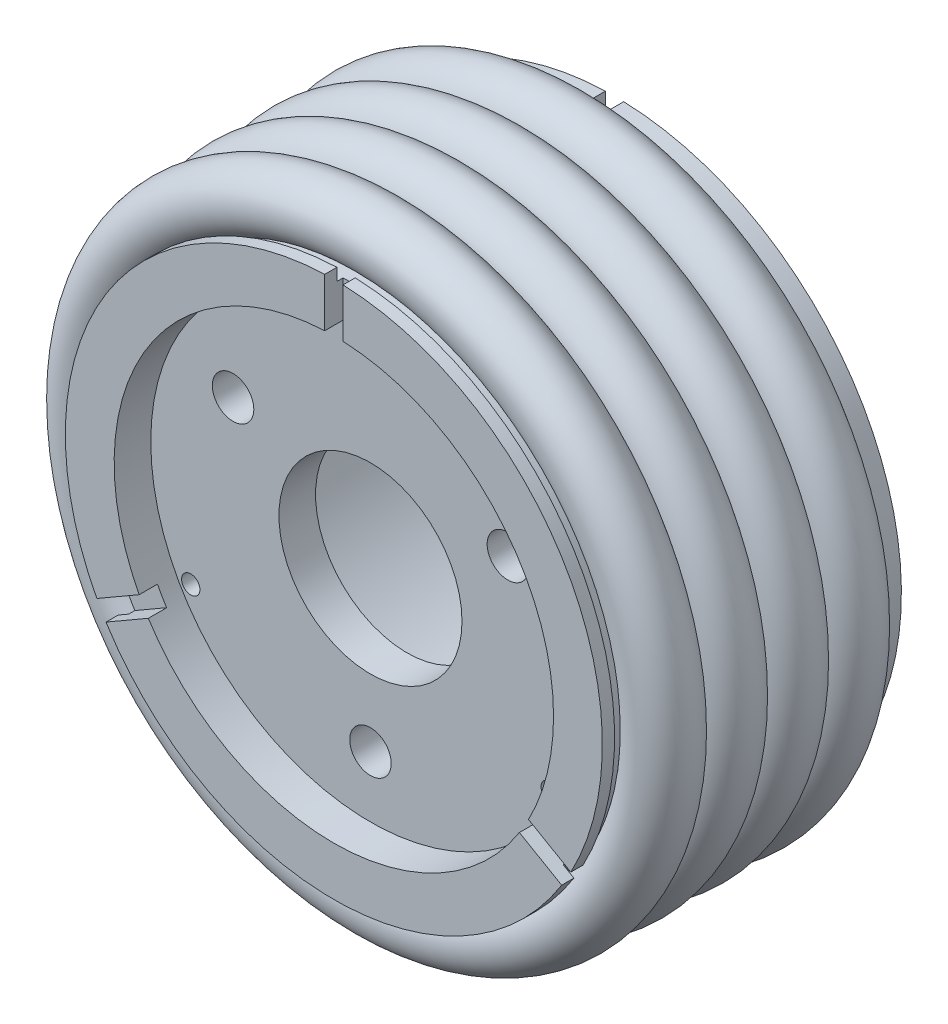
from build123d import *

# Parameters (mm, degrees)
HOLE_WIZARD_M3_1_D       = 3.4
HOLE_WIZARD_M3_1_DEPTH   = 23
HOLE_WIZARD_M3_1_TIP     = 1.021463052
SKETCH_4_W               = 1
SKETCH_4_H               = 1
SKETCH_4_W_2             = 2.5
SKETCH_4_H_2             = 2
SKETCH_6_W               = 1.5
SKETCH_6_H               = 2
SKETCH_6_H_2             = 1.5
CUT_EXTRUDE_1_DEPTH      = 36.167456547
SKETCH_7_R               = 0.75
CUT_EXTRUDE_2_DEPTH      = 39.787884706
PATTERN_CIRCULAR_1_COUNT = 3
SKETCH_5_R               = 2.5
PATTERN_LINEAR_2_COUNT   = 4
PATTERN_LINEAR_2_PITCH   = 5


with BuildPart() as part:
    # 草图1 → 旋转1 (revolve)
    with BuildSketch(Plane(origin=(0, 0, 0), x_dir=(0, 0, -1), z_dir=(1, 0, 0)), mode=Mode.PRIVATE) as revolve_1_sk:
        Polygon((-11.5, 21), (-11.5, 18), (-8.5, 18), (-8.5, 7.5), (-5.5, 7.5), (-5.5, 18), (11.5, 18), (11.5, 21), align=None)
    revolve(revolve_1_sk.sketch.rotate(Axis((0, 0, 11.5), (0, 0, -1)), 90), axis=Axis((0, 0, 11.5), (0, 0, -1)))

    # M3 间隙孔1
    with Locations(Plane.XY.offset(8.5)):
        with Locations((11.258330249, 6.5), (0, -13), (-11.258330249, 6.5)):
            Hole(HOLE_WIZARD_M3_1_D / 2, depth=HOLE_WIZARD_M3_1_DEPTH)
            with Locations((0, 0, -(HOLE_WIZARD_M3_1_DEPTH + HOLE_WIZARD_M3_1_TIP / 2))):  # 118° drill point
                Cone(0, HOLE_WIZARD_M3_1_D / 2, HOLE_WIZARD_M3_1_TIP, mode=Mode.SUBTRACT)

    # 草图4 → Revolve 1466 (revolve)
    with BuildSketch(Plane(origin=(0, 0, 0), x_dir=(1, 0, 0), z_dir=(0, 1, 0))):
        with Locations((21.5, -11)):
            Rectangle(SKETCH_4_W, SKETCH_4_H)
        with Locations((22.25, 10.5)):
            Rectangle(SKETCH_4_W_2, SKETCH_4_H_2)
    revolve(axis=Axis((0, 0, 10.547281455), (0, 0, -1)))

    # 草图6 → 切除-拉伸1 (cut, through all)
    with BuildSketch(Plane(origin=(0, 0, 0), x_dir=(1, 0, 0), z_dir=(0, 1, 0))):
        with Locations((0, 10.5)):
            Rectangle(SKETCH_6_W, SKETCH_6_H)
        with Locations((0, -10.75)):
            Rectangle(SKETCH_6_W, SKETCH_6_H_2)
    cut_extrude_1 = extrude(amount=CUT_EXTRUDE_1_DEPTH, mode=Mode.SUBTRACT)

    # 草图7 → 切除-拉伸2 (cut, through all)
    with BuildSketch(Plane.XY.offset(8.5)):
        with Locations((0, 17)):
            Circle(SKETCH_7_R)
    cut_extrude_2 = extrude(amount=-CUT_EXTRUDE_2_DEPTH, mode=Mode.SUBTRACT)

    # 阵列(圆周)1: 切除-拉伸1, 切除-拉伸2 ×3 about axis
    pattern_circular_1_axis = Axis((0, 0, 0), (0, 0, 1))
    add([cut_extrude_1.rotate(pattern_circular_1_axis, i * 360 / PATTERN_CIRCULAR_1_COUNT) for i in range(1, PATTERN_CIRCULAR_1_COUNT)], mode=Mode.SUBTRACT)
    add([cut_extrude_2.rotate(pattern_circular_1_axis, i * 360 / PATTERN_CIRCULAR_1_COUNT) for i in range(1, PATTERN_CIRCULAR_1_COUNT)], mode=Mode.SUBTRACT)


with BuildPart() as body_2:
    # 草图5 → 旋转3 (revolve)
    with BuildSketch(Plane(origin=(0, 0, 0), x_dir=(1, 0, 0), z_dir=(0, 1, 0)), mode=Mode.PRIVATE) as revolve_3_sk:
        with Locations((23.5, 7)):
            Circle(SKETCH_5_R)
    revolve(revolve_3_sk.sketch.rotate(Axis((0, 0, 0), (0, 0, -1)), 27.953286902), axis=Axis((0, 0, 0), (0, 0, -1)))


with BuildPart() as pattern_linear_2_1:
    # 阵列(线性)2: pattern copy
    add(body_2.part.moved(Location(Vector(0, 0, 1) * (1 * PATTERN_LINEAR_2_PITCH))))


with BuildPart() as pattern_linear_2_2:
    # 阵列(线性)2: pattern copy
    add(body_2.part.moved(Location(Vector(0, 0, 1) * (2 * PATTERN_LINEAR_2_PITCH))))


with BuildPart() as pattern_linear_2_3:
    # 阵列(线性)2: pattern copy
    add(body_2.part.moved(Location(Vector(0, 0, 1) * (3 * PATTERN_LINEAR_2_PITCH))))


solid = Compound([part.part, body_2.part, pattern_linear_2_1.part, pattern_linear_2_2.part, pattern_linear_2_3.part])
